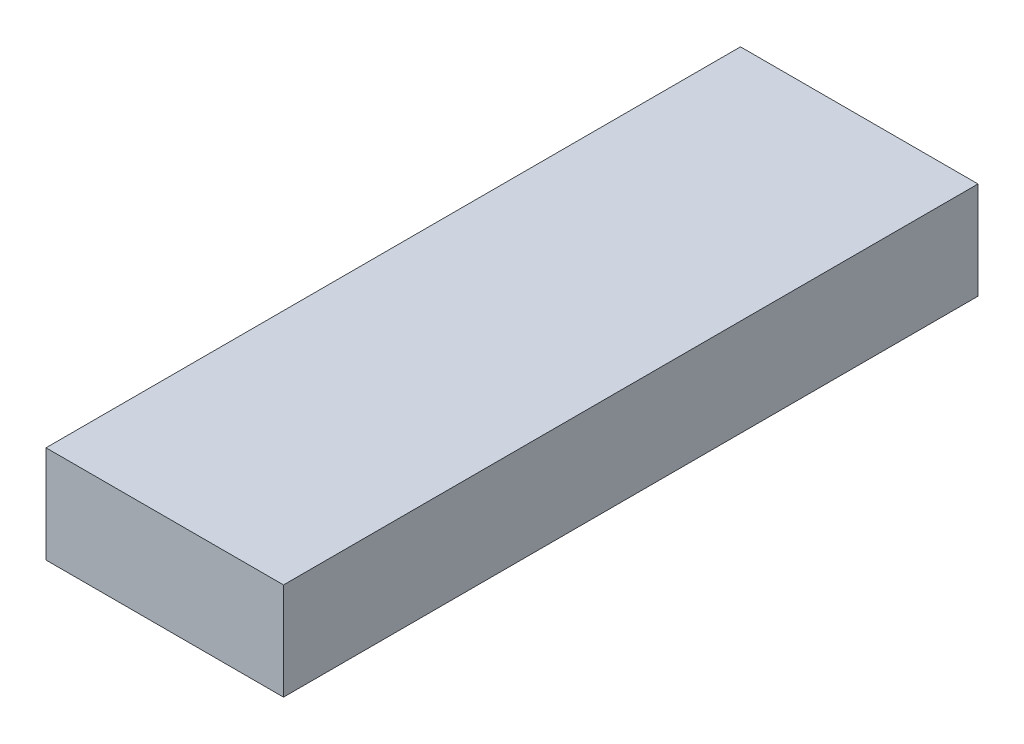
from build123d import *

# Parameters (mm, degrees)
SKETCH1_W           = 3.42
SKETCH1_H           = 1.4
BOSS_EXTRUDE1_DEPTH = 10


with BuildPart() as part:
    # Sketch1 → Boss-Extrude1 (new body)
    with BuildSketch(Plane.XY):
        Rectangle(SKETCH1_W, SKETCH1_H)
    extrude(amount=BOSS_EXTRUDE1_DEPTH)


solid = part.part
